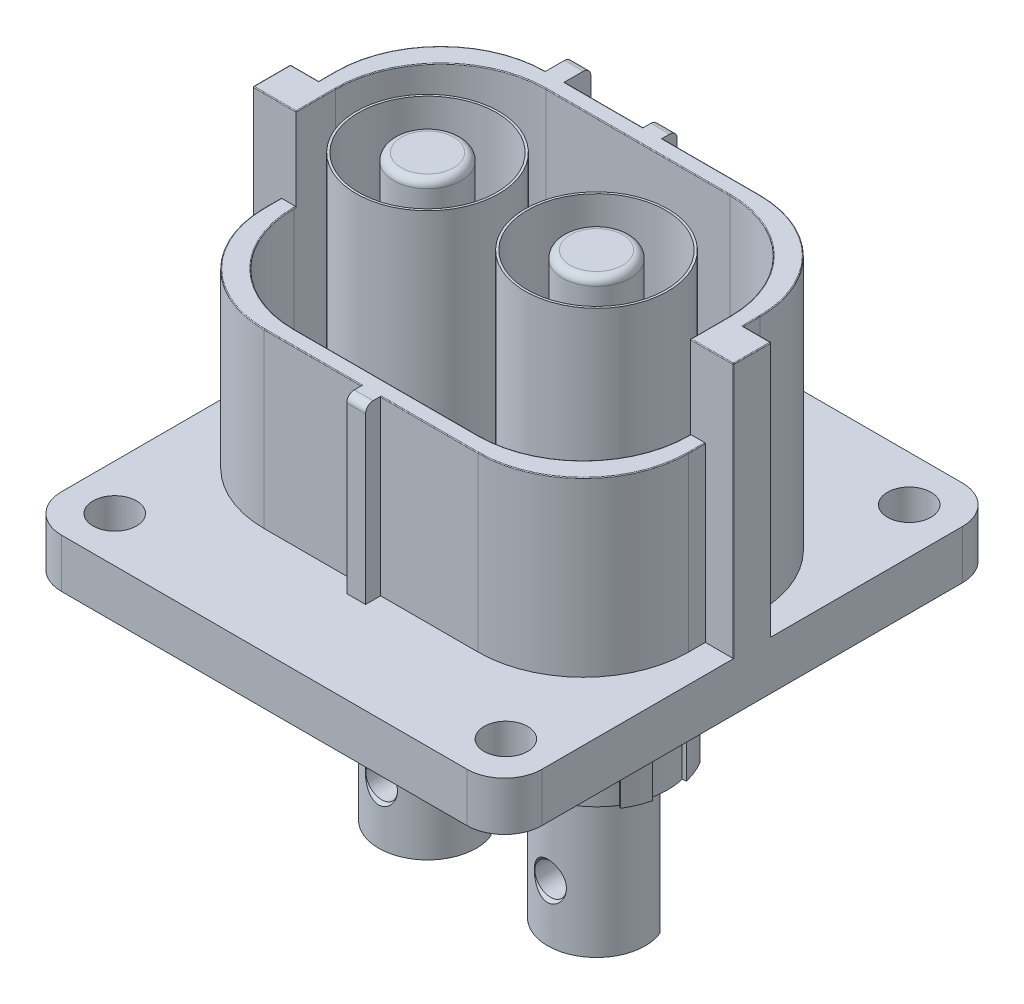
from build123d import *

# Parameters (mm, degrees)
SKETCH1_R                                      = 2.9
SKETCH1_R_2                                    = 1.5
BOSS_EXTRUDE1_DEPTH                            = 6.5
BOSS_EXTRUDE2_DEPTH                            = 29.5
SKETCH1_6_R                                    = 9.5
SKETCH1_6_R_2                                  = 9.2
BOSS_EXTRUDE3_DEPTH                            = 42
SKETCH1_7_R                                    = 4.5
BOSS_EXTRUDE4_DEPTH                            = 42
BOSS_EXTRUDE5_DEPTH                            = 40.5
FILLET1_R                                      = 1
FILLET2_R                                      = 1
FILLET3_R                                      = 0.1
BOSS_EXTRUDE6_DEPTH                            = 18.5
BOSS_EXTRUDE7_START                            = 15.5
SKETCH2_R                                      = 1.5
BOSS_EXTRUDE7_DEPTH                            = 15.5
BOSS_EXTRUDE8_DEPTH                            = 19.5
CSK_FOR_M5_FLAT_HEAD_MACHINE_SCREW1_AT_2_COUNT = 2
CSK_FOR_M5_FLAT_HEAD_MACHINE_SCREW1_AT_2_PITCH = 22.5


with BuildPart() as part:
    # Sketch1 → Boss-Extrude1 (new body)
    with BuildSketch(Plane(origin=(0, 0, 0), x_dir=(1, 0, 0), z_dir=(0, 1, 0))):
        with BuildLine():
            ThreePointArc((-32, -28), (-30.535533906, -31.535533906), (-27, -33))
            Line((-27, -33), (27, -33))
            ThreePointArc((27, -33), (30.535533906, -31.535533906), (32, -28))
            Line((32, -28), (32, 28))
            ThreePointArc((32, 28), (30.535533906, 31.535533906), (27, 33))
            Line((27, 33), (-27, 33))
            ThreePointArc((-27, 33), (-30.535533906, 31.535533906), (-32, 28))
            Line((-32, 28), (-32, -28))
        make_face()
        with Locations((25.95, 26.95)):
            Circle(SKETCH1_R, mode=Mode.SUBTRACT)
        with Locations((-25.95, 26.95)):
            Circle(SKETCH1_R, mode=Mode.SUBTRACT)
        with Locations((26.1, -26.915625)):
            Circle(SKETCH1_R, mode=Mode.SUBTRACT)
        with Locations((-25.95, -26.95)):
            Circle(SKETCH1_R, mode=Mode.SUBTRACT)
        with Locations((1.925, 9.75)):
            Circle(SKETCH1_R_2, mode=Mode.SUBTRACT)
        with Locations((-1.925, 9.75)):
            Circle(SKETCH1_R_2, mode=Mode.SUBTRACT)
    extrude(amount=BOSS_EXTRUDE1_DEPTH)

    # Sketch1<5> → Boss-Extrude2 (add)
    with BuildSketch(Plane(origin=(0, 0, 0), x_dir=(1, 0, 0), z_dir=(0, 1, 0))):
        with BuildLine():
            Line((-26.25, -2.5), (-28.25, -2.5))
            Line((-28.25, -2.5), (-28.25, -4.75))
            ThreePointArc((-28.25, -4.75), (-24.149494937, -14.649494937), (-14.25, -18.75))
            Line((-14.25, -18.75), (-1.25, -18.75))
            Line((-1.25, -18.75), (-1.25, -20.75))
            Line((-1.25, -20.75), (1.25, -20.75))
            Line((1.25, -20.75), (1.25, -18.75))
            Line((1.25, -18.75), (14.25, -18.75))
            ThreePointArc((14.25, -18.75), (24.149494937, -14.649494937), (28.25, -4.75))
            Line((28.25, -4.75), (28.25, -2.5))
            Line((28.25, -2.5), (26.25, -2.5))
            Line((26.25, -2.5), (26.25, -2.75))
            ThreePointArc((26.25, -2.75), (22.149494937, -12.649494937), (12.25, -16.75))
            Line((12.25, -16.75), (-12.25, -16.75))
            ThreePointArc((-12.25, -16.75), (-22.149494937, -12.649494937), (-26.25, -2.75))
            Line((-26.25, -2.75), (-26.25, -2.5))
        make_face()
    extrude(amount=BOSS_EXTRUDE2_DEPTH)

    # Sketch1<6> → Boss-Extrude3 (add)
    # profile 1 of 2: a face of its own
    with BuildSketch(Plane(origin=(0, 0, 0), x_dir=(1, 0, 0), z_dir=(0, 1, 0))):
        with Locations((-11.25, 0)):
            Circle(SKETCH1_6_R)
        with Locations((-11.25, 0)):
            Circle(SKETCH1_6_R_2, mode=Mode.SUBTRACT)
    # profile 2 of 2: a face of its own
    with BuildSketch(Plane(origin=(0, 0, 0), x_dir=(1, 0, 0), z_dir=(0, 1, 0))):
        with Locations((11.25, 0)):
            Circle(SKETCH1_6_R)
        with Locations((11.25, 0)):
            Circle(SKETCH1_6_R_2, mode=Mode.SUBTRACT)
    extrude(amount=BOSS_EXTRUDE3_DEPTH)

    # Sketch1<7> → Boss-Extrude4 (add)
    with BuildSketch(Plane(origin=(0, 0, 0), x_dir=(1, 0, 0), z_dir=(0, 1, 0))):
        with Locations((-11.25, 0)):
            Circle(SKETCH1_7_R)
        with Locations((11.25, 0)):
            Circle(SKETCH1_7_R)
    extrude(amount=BOSS_EXTRUDE4_DEPTH)

    # Sketch1<8> → Boss-Extrude5 (add)
    with BuildSketch(Plane(origin=(0, 0, 0), x_dir=(1, 0, 0), z_dir=(0, 1, 0))):
        with BuildLine():
            Line((-32, 2.5), (-32, -2.5))
            Line((-32, -2.5), (-26.25, -2.5))
            Line((-26.25, -2.5), (-26.25, 2.75))
            ThreePointArc((-26.25, 2.75), (-22.149494937, 12.649494937), (-12.25, 16.75))
            Line((-12.25, 16.75), (12.25, 16.75))
            ThreePointArc((12.25, 16.75), (22.149494937, 12.649494937), (26.25, 2.75))
            Line((26.25, 2.75), (26.25, -2.5))
            Line((26.25, -2.5), (32, -2.5))
            Line((32, -2.5), (32, 2.5))
            Line((32, 2.5), (28.25, 2.5))
            Line((28.25, 2.5), (28.25, 4.75))
            ThreePointArc((28.25, 4.75), (24.149494937, 14.649494937), (14.25, 18.75))
            Line((14.25, 18.75), (1.25, 18.75))
            Line((1.25, 18.75), (1.25, 20.75))
            Line((1.25, 20.75), (-1.25, 20.75))
            Line((-1.25, 20.75), (-1.25, 18.75))
            Line((-1.25, 18.75), (-11.75, 18.75))
            Line((-11.75, 18.75), (-11.75, 22.25))
            Line((-11.75, 22.25), (-14.25, 22.25))
            Line((-14.25, 22.25), (-14.25, 18.75))
            ThreePointArc((-14.25, 18.75), (-24.149494937, 14.649494937), (-28.25, 4.75))
            Line((-28.25, 4.75), (-28.25, 2.5))
            Line((-28.25, 2.5), (-32, 2.5))
        make_face()
    extrude(amount=BOSS_EXTRUDE5_DEPTH)

    # Fillet1
    fillet1_edges = [part.edges().sort_by_distance(p)[0] for p in [
        (0, 29.5, 20.75),
        (-13, 40.5, -22.25),
        (0, 40.5, -20.75),
    ]]
    fillet(fillet1_edges, radius=FILLET1_R)

    # Fillet2
    fillet2_edges = [part.edges().sort_by_distance(p)[0] for p in [
        (6.75, 42, 0),
        (-15.75, 42, 0),
    ]]
    fillet(fillet2_edges, radius=FILLET2_R)

    # Fillet3
    fillet3_edges = [part.edges().sort_by_distance(p)[0] for p in [
        (28.25, 29.5, 3.625),
        (24.149494937, 29.5, 14.649494937),
        (-28.25, 29.5, 3.625),
        (-7.75, 29.5, 18.75),
        (-26.25, 29.5, 2.625),
        (26.25, 29.5, 2.625),
        (22.149494937, 29.5, 12.649494937),
        (0, 29.5, 16.75),
        (-26.25, 40.5, -0.125),
        (-22.149494937, 40.5, -12.649494937),
        (0, 40.5, -16.75),
        (22.149494937, 40.5, -12.649494937),
        (-28.25, 40.5, -3.625),
        (7.75, 40.5, -18.75),
        (28.25, 40.5, -3.625),
        (7.75, 29.5, 18.75),
        (-24.149494937, 29.5, 14.649494937),
        (-22.149494937, 29.5, 12.649494937),
        (-32, 23.5, 2.5),
        (-32, 23.5, -2.5),
        (-32, 40.5, 0),
        (-29.125, 40.5, 2.5),
        (-30.125, 40.5, -2.5),
        (26.25, 40.5, -0.125),
        (32, 23.5, -2.5),
        (32, 23.5, 2.5),
        (29.125, 40.5, 2.5),
        (32, 40.5, 0),
        (30.125, 40.5, -2.5),
        (-24.149494937, 40.5, -14.649494937),
        (-6.5, 40.5, -18.75),
        (24.149494937, 40.5, -14.649494937),
    ]]
    fillet(fillet3_edges, radius=FILLET3_R)

    # Sketch1<9> → Boss-Extrude6 (add)
    with BuildSketch(Plane(origin=(0, 0, 0), x_dir=(1, 0, 0), z_dir=(0, 1, 0))):
        with BuildLine():
            Line((4, 12.75), (-4, 12.75))
            ThreePointArc((-4, 12.75), (-4.707106781, 12.457106781), (-5, 11.75))
            Line((-5, 11.75), (-5, 7.75))
            ThreePointArc((-5, 7.75), (-4.707106781, 7.042893219), (-4, 6.75))
            Line((-4, 6.75), (4, 6.75))
            ThreePointArc((4, 6.75), (4.707106781, 7.042893219), (5, 7.75))
            Line((5, 7.75), (5, 11.75))
            ThreePointArc((5, 11.75), (4.707106781, 12.457106781), (4, 12.75))
        make_face()
        with BuildLine():
            ThreePointArc((-4, 11.25), (-3.853553391, 11.603553391), (-3.5, 11.75))
            Line((-3.5, 11.75), (3.5, 11.75))
            ThreePointArc((3.5, 11.75), (3.853553391, 11.603553391), (4, 11.25))
            Line((4, 11.25), (4, 8.25))
            ThreePointArc((4, 8.25), (3.853553391, 7.896446609), (3.5, 7.75))
            Line((3.5, 7.75), (-3.5, 7.75))
            ThreePointArc((-3.5, 7.75), (-3.853553391, 7.896446609), (-4, 8.25))
            Line((-4, 8.25), (-4, 11.25))
        make_face(mode=Mode.SUBTRACT)
    extrude(amount=BOSS_EXTRUDE6_DEPTH)

    # Sketch2 → Boss-Extrude7 (add)
    # profile 1 of 3: a face of its own
    with BuildSketch(Plane.XZ.offset(BOSS_EXTRUDE7_START)):
        with BuildLine():
            ThreePointArc((-9.104887965, 9.254647176), (-11.25, 9.5), (-13.395112035, 9.254647176))
            Line((-13.395112035, 9.254647176), (-13.508012669, 9.74173387))
            ThreePointArc((-13.508012669, 9.74173387), (-15.076834324, 9.238795325), (-16.54179001, 8.48510215))
            Line((-16.54179001, 8.48510215), (-16.277200509, 8.060847042))
            ThreePointArc((-16.277200509, 8.060847042), (-17.967514421, 6.717514421), (-19.310847042, 5.027200509))
            Line((-19.310847042, 5.027200509), (-19.73510215, 5.29179001))
            ThreePointArc((-19.73510215, 5.29179001), (-20.488795325, 3.826834324), (-20.99173387, 2.258012669))
            Line((-20.99173387, 2.258012669), (-20.504647176, 2.145112035))
            ThreePointArc((-20.504647176, 2.145112035), (-20.75, 0), (-20.504647176, -2.145112035))
            Line((-20.504647176, -2.145112035), (-20.99173387, -2.258012669))
            ThreePointArc((-20.99173387, -2.258012669), (-20.488795325, -3.826834324), (-19.73510215, -5.29179001))
            Line((-19.73510215, -5.29179001), (-19.310847042, -5.027200509))
            ThreePointArc((-19.310847042, -5.027200509), (-17.967514421, -6.717514421), (-16.277200509, -8.060847042))
            Line((-16.277200509, -8.060847042), (-16.54179001, -8.48510215))
            ThreePointArc((-16.54179001, -8.48510215), (-15.076834324, -9.238795325), (-13.508012669, -9.74173387))
            Line((-13.508012669, -9.74173387), (-13.395112035, -9.254647176))
            ThreePointArc((-13.395112035, -9.254647176), (-11.25, -9.5), (-9.104887965, -9.254647176))
            Line((-9.104887965, -9.254647176), (-8.991987331, -9.74173387))
            ThreePointArc((-8.991987331, -9.74173387), (-7.423165676, -9.238795325), (-5.95820999, -8.48510215))
            Line((-5.95820999, -8.48510215), (-6.222799491, -8.060847042))
            ThreePointArc((-6.222799491, -8.060847042), (-4.532485579, -6.717514421), (-3.189152958, -5.027200509))
            Line((-3.189152958, -5.027200509), (-2.76489785, -5.29179001))
            ThreePointArc((-2.76489785, -5.29179001), (-2.011204675, -3.826834324), (-1.50826613, -2.258012669))
            Line((-1.50826613, -2.258012669), (-1.995352824, -2.145112035))
            ThreePointArc((-1.995352824, -2.145112035), (-1.75, 0), (-1.995352824, 2.145112035))
            Line((-1.995352824, 2.145112035), (-1.50826613, 2.258012669))
            ThreePointArc((-1.50826613, 2.258012669), (-2.011204675, 3.826834324), (-2.76489785, 5.29179001))
            Line((-2.76489785, 5.29179001), (-3.189152958, 5.027200509))
            ThreePointArc((-3.189152958, 5.027200509), (-4.532485579, 6.717514421), (-6.222799491, 8.060847042))
            Line((-6.222799491, 8.060847042), (-5.95820999, 8.48510215))
            ThreePointArc((-5.95820999, 8.48510215), (-7.423165676, 9.238795325), (-8.991987331, 9.74173387))
            Line((-8.991987331, 9.74173387), (-9.104887965, 9.254647176))
        make_face()
    # profile 2 of 3: a face of its own
    with BuildSketch(Plane.XZ.offset(BOSS_EXTRUDE7_START)):
        with BuildLine():
            ThreePointArc((-3.992709198, -6.879805972), (-4.178932188, -7.071067812), (-4.370194028, -7.257290802))
            ThreePointArc((-4.370194028, -7.257290802), (-4.467004144, -7.495239356), (-4.5, -7.75))
            Line((-4.5, -7.75), (-4.5, -11.75))
            ThreePointArc((-4.5, -11.75), (-4.207106781, -12.457106781), (-3.5, -12.75))
            Line((-3.5, -12.75), (3.5, -12.75))
            ThreePointArc((3.5, -12.75), (4.207106781, -12.457106781), (4.5, -11.75))
            Line((4.5, -11.75), (4.5, -7.75))
            ThreePointArc((4.5, -7.75), (4.467004144, -7.495239356), (4.370194028, -7.257290802))
            ThreePointArc((4.370194028, -7.257290802), (4.178932188, -7.071067812), (3.992709198, -6.879805972))
            ThreePointArc((3.992709198, -6.879805972), (3.754760644, -6.782995856), (3.5, -6.75))
            Line((3.5, -6.75), (-3.5, -6.75))
            ThreePointArc((-3.5, -6.75), (-3.754760644, -6.782995856), (-3.992709198, -6.879805972))
        make_face()
        with Locations((-1.925, -9.75)):
            Circle(SKETCH2_R, mode=Mode.SUBTRACT)
        with Locations((1.925, -9.75)):
            Circle(SKETCH2_R, mode=Mode.SUBTRACT)
    # profile 3 of 3: a face of its own
    with BuildSketch(Plane.XZ.offset(BOSS_EXTRUDE7_START)):
        with BuildLine():
            ThreePointArc((1.50826613, -2.258012669), (2.011204675, -3.826834324), (2.76489785, -5.29179001))
            Line((2.76489785, -5.29179001), (3.189152958, -5.027200509))
            ThreePointArc((3.189152958, -5.027200509), (4.532485579, -6.717514421), (6.222799491, -8.060847042))
            Line((6.222799491, -8.060847042), (5.95820999, -8.48510215))
            ThreePointArc((5.95820999, -8.48510215), (7.423165676, -9.238795325), (8.991987331, -9.74173387))
            Line((8.991987331, -9.74173387), (9.104887965, -9.254647176))
            ThreePointArc((9.104887965, -9.254647176), (11.25, -9.5), (13.395112035, -9.254647176))
            Line((13.395112035, -9.254647176), (13.508012669, -9.74173387))
            ThreePointArc((13.508012669, -9.74173387), (15.076834324, -9.238795325), (16.54179001, -8.48510215))
            Line((16.54179001, -8.48510215), (16.277200509, -8.060847042))
            ThreePointArc((16.277200509, -8.060847042), (17.967514421, -6.717514421), (19.310847042, -5.027200509))
            Line((19.310847042, -5.027200509), (19.73510215, -5.29179001))
            ThreePointArc((19.73510215, -5.29179001), (20.488795325, -3.826834324), (20.99173387, -2.258012669))
            Line((20.99173387, -2.258012669), (20.504647176, -2.145112035))
            ThreePointArc((20.504647176, -2.145112035), (20.75, 0), (20.504647176, 2.145112035))
            Line((20.504647176, 2.145112035), (20.99173387, 2.258012669))
            ThreePointArc((20.99173387, 2.258012669), (20.488795325, 3.826834324), (19.73510215, 5.29179001))
            Line((19.73510215, 5.29179001), (19.310847042, 5.027200509))
            ThreePointArc((19.310847042, 5.027200509), (17.967514421, 6.717514421), (16.277200509, 8.060847042))
            Line((16.277200509, 8.060847042), (16.54179001, 8.48510215))
            ThreePointArc((16.54179001, 8.48510215), (15.076834324, 9.238795325), (13.508012669, 9.74173387))
            Line((13.508012669, 9.74173387), (13.395112035, 9.254647176))
            ThreePointArc((13.395112035, 9.254647176), (11.25, 9.5), (9.104887965, 9.254647176))
            Line((9.104887965, 9.254647176), (8.991987331, 9.74173387))
            ThreePointArc((8.991987331, 9.74173387), (7.423165676, 9.238795325), (5.95820999, 8.48510215))
            Line((5.95820999, 8.48510215), (6.222799491, 8.060847042))
            ThreePointArc((6.222799491, 8.060847042), (4.532485579, 6.717514421), (3.189152958, 5.027200509))
            Line((3.189152958, 5.027200509), (2.76489785, 5.29179001))
            ThreePointArc((2.76489785, 5.29179001), (2.011204675, 3.826834324), (1.50826613, 2.258012669))
            Line((1.50826613, 2.258012669), (1.995352824, 2.145112035))
            ThreePointArc((1.995352824, 2.145112035), (1.75, 0), (1.995352824, -2.145112035))
            Line((1.995352824, -2.145112035), (1.50826613, -2.258012669))
        make_face()
    extrude(amount=-BOSS_EXTRUDE7_DEPTH)

    # Sketch3 → Boss-Extrude8 (add)
    with BuildSketch(Plane.XZ.offset(15.5)):
        with BuildLine():
            Line((-17.277555337, -2.4328125), (-5.222444663, -2.4328125))
            ThreePointArc((-5.222444663, -2.4328125), (-11.25, 6.5), (-17.277555337, -2.4328125))
        make_face()
        with BuildLine():
            Line((5.222444663, -2.4328125), (17.277555337, -2.4328125))
            ThreePointArc((17.277555337, -2.4328125), (11.25, 6.5), (5.222444663, -2.4328125))
        make_face()
    extrude(amount=BOSS_EXTRUDE8_DEPTH)

    # Sketch8 → CSK for M5 Flat Head Machine Screw1 (revolve, cut)
    with BuildSketch(Plane(origin=(11.25, -27.5, -2.4328125), x_dir=(0, 1, 0), z_dir=(1, 0, 0))):
        Polygon((0, 0), (0, 8.9328125), (2.5, 8.9328125), (2.1, 8.5328125), (2.1, 0.4), (2.5, 0), align=None)
    csk_for_m5_flat_head_machine_screw1 = revolve(axis=Axis((11.25, -27.5, -8.7828125), (0, 0, 1)), mode=Mode.SUBTRACT)

    # CSK for M5 Flat Head Machine Screw1 at 2: CSK for M5 Flat Head Machine Screw1 ×2
    with Locations(*[(-i * CSK_FOR_M5_FLAT_HEAD_MACHINE_SCREW1_AT_2_PITCH, 0, 0) for i in range(1, CSK_FOR_M5_FLAT_HEAD_MACHINE_SCREW1_AT_2_COUNT)]):
        add(csk_for_m5_flat_head_machine_screw1, mode=Mode.SUBTRACT)


solid = part.part
